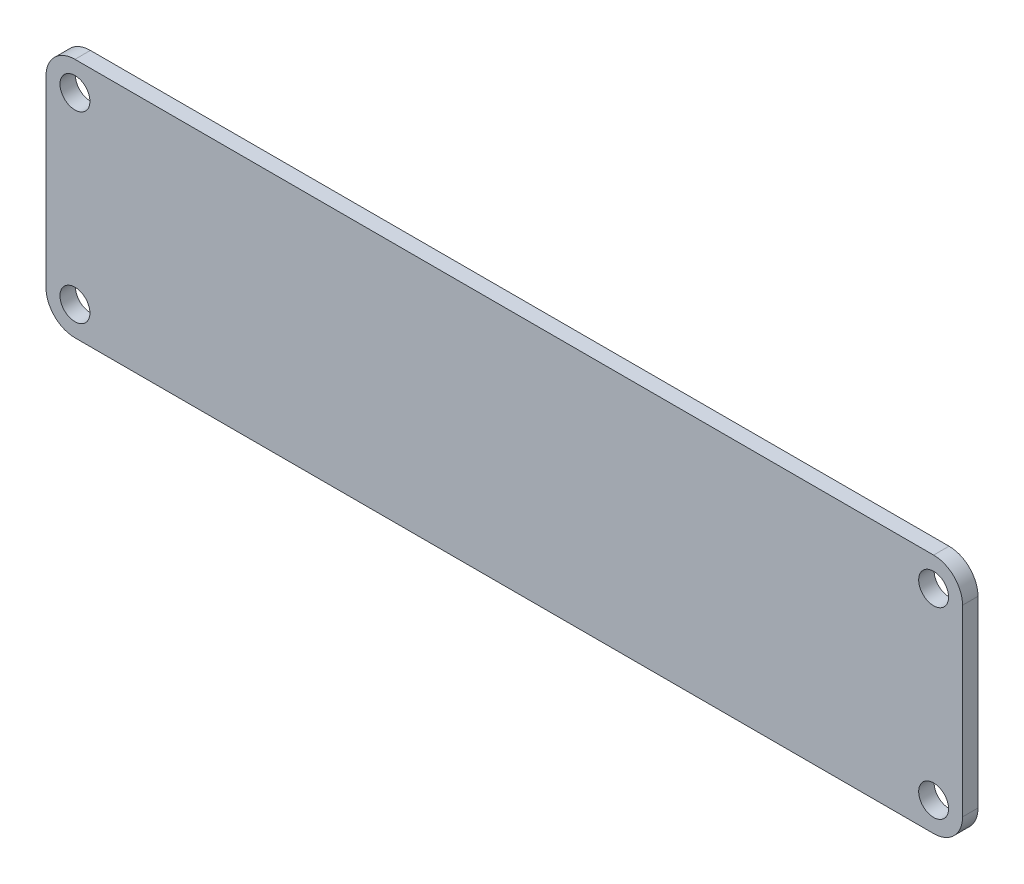
from build123d import *

# Parameters (mm, degrees)
SKETCH_1_R      = 1.55
EXTRUDE_1_DEPTH = 1.6


with BuildPart() as part:
    # Эскиз1 → Бобышка-Вытянуть1 (new body)
    with BuildSketch(Plane.XY):
        with BuildLine():
            Line((-44.5, 12.5), (44.5, 12.5))
            ThreePointArc((44.5, 12.5), (46.621320344, 11.621320344), (47.5, 9.5))
            Line((47.5, 9.5), (47.5, -9.5))
            ThreePointArc((47.5, -9.5), (46.621320344, -11.621320344), (44.5, -12.5))
            Line((44.5, -12.5), (-44.5, -12.5))
            ThreePointArc((-44.5, -12.5), (-46.621320344, -11.621320344), (-47.5, -9.5))
            Line((-47.5, -9.5), (-47.5, 9.5))
            ThreePointArc((-47.5, 9.5), (-46.621320344, 11.621320344), (-44.5, 12.5))
        make_face()
        with Locations((-44.5, 9.5)):
            Circle(SKETCH_1_R, mode=Mode.SUBTRACT)
        with Locations((-44.5, -9.5)):
            Circle(SKETCH_1_R, mode=Mode.SUBTRACT)
        with Locations((44.5, -9.5)):
            Circle(SKETCH_1_R, mode=Mode.SUBTRACT)
        with Locations((44.5, 9.5)):
            Circle(SKETCH_1_R, mode=Mode.SUBTRACT)
    extrude(amount=EXTRUDE_1_DEPTH)


solid = part.part
